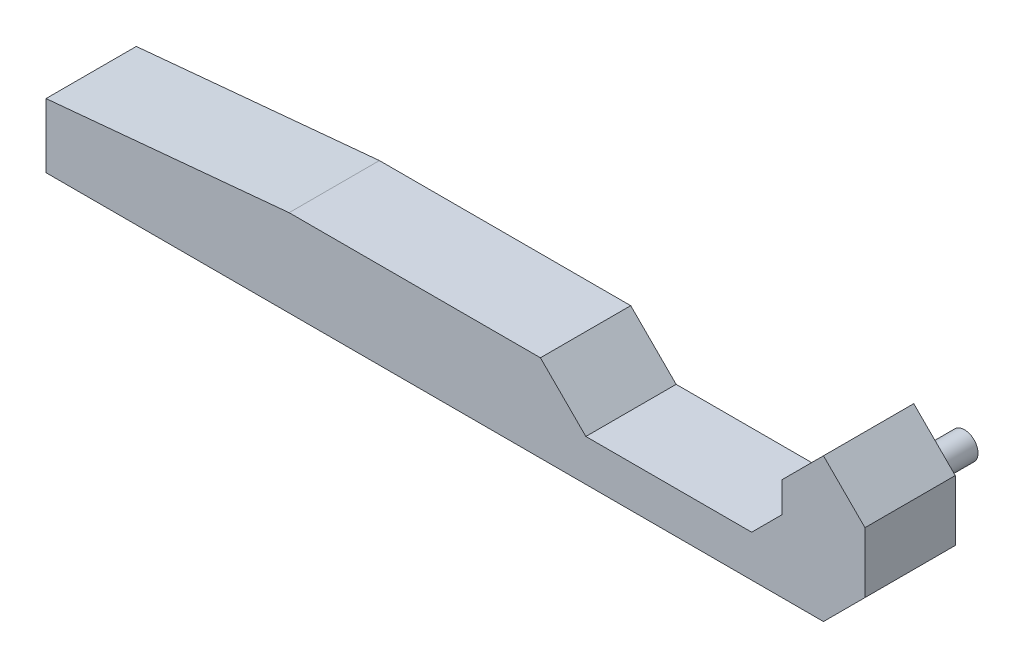
from build123d import *

# Parameters (mm, degrees)
BOSS_EXTRUDE1_DEPTH = 10
SKETCH2_R           = 1.5
BOSS_EXTRUDE2_DEPTH = 5


with BuildPart() as part:
    # Sketch1 → Boss-Extrude1 (new body)
    with BuildSketch(Plane.XY):
        Polygon((0, 0), (0, -6.709191333), (-4.597281239, -11.306472572), (-57.229872555, -11.306472572), (-83.792838338, -11.306472572), (-90.706486966, -11.306472572), (-90.706486966, -4.193244583), (-63.77964494, -1.677297833), (-49.58847144, -1.677297833), (-35.945470397, -1.677297833), (-30.913576897, -6.709191333), (-12.549158145, -6.709191333), (-9.194562479, -3.354595666), (-9.194562479, 0), (-4.597281239, 4.597281239), align=None)
    extrude(amount=BOSS_EXTRUDE1_DEPTH)

    # Sketch2 → Boss-Extrude2 (add)
    with BuildSketch(Plane(origin=(0, 0, 0), x_dir=(-1, 0, 0), z_dir=(0, 0, -1))):
        with Locations(Location((3.981479871, -1.591444595, 0), (0, 0, 180))):
            Circle(SKETCH2_R)
    extrude(amount=BOSS_EXTRUDE2_DEPTH)


solid = part.part
